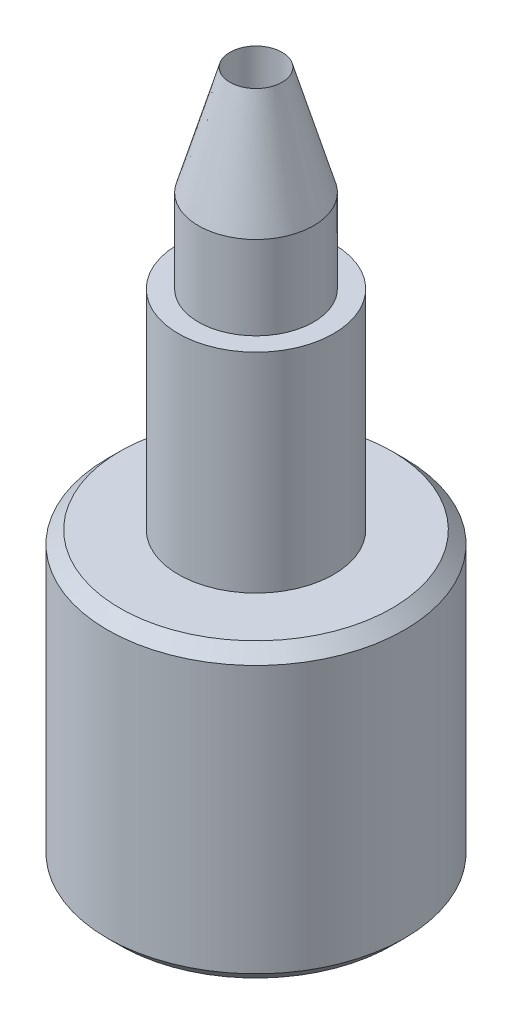
from build123d import *

# Parameters (mm, degrees)
CHAMFER1_SIZE      = 0.381
SKETCH2_R          = 2.667
CUT_EXTRUDE1_DEPTH = 6.35
SKETCH3_R          = 0.79375
CUT_EXTRUDE2_DEPTH = 23.030279682


with BuildPart() as part:
    # Sketch1 → Revolve1 (revolve)
    with BuildSketch(Plane.XY):
        Polygon((0, 21.082), (0.79375, 21.082), (1.7526, 17.78), (1.7526, 15.24), (2.3622, 15.24), (2.3622, 8.89), (4.5212, 8.89), (4.5212, 0), (0, 0), align=None)
    revolve(axis=Axis((0, 0, 0), (0, 1, 0)))

    # Chamfer1
    chamfer1_edges = [part.edges().sort_by_distance(p)[0] for p in [
        (-4.5212, 0, 0),
        (-4.5212, 8.89, 0),
    ]]
    chamfer(chamfer1_edges, length=CHAMFER1_SIZE)

    # Sketch2 → Cut-Extrude1 (cut)
    with BuildSketch(Plane.XZ):
        Circle(SKETCH2_R)
    extrude(amount=-CUT_EXTRUDE1_DEPTH, mode=Mode.SUBTRACT)

    # Sketch3 → Cut-Extrude2 (cut, through all)
    with BuildSketch(Plane(origin=(0, 21.082, 0), x_dir=(1, 0, 0), z_dir=(0, 1, 0))):
        Circle(SKETCH3_R)
    extrude(amount=-CUT_EXTRUDE2_DEPTH, mode=Mode.SUBTRACT)


solid = part.part
